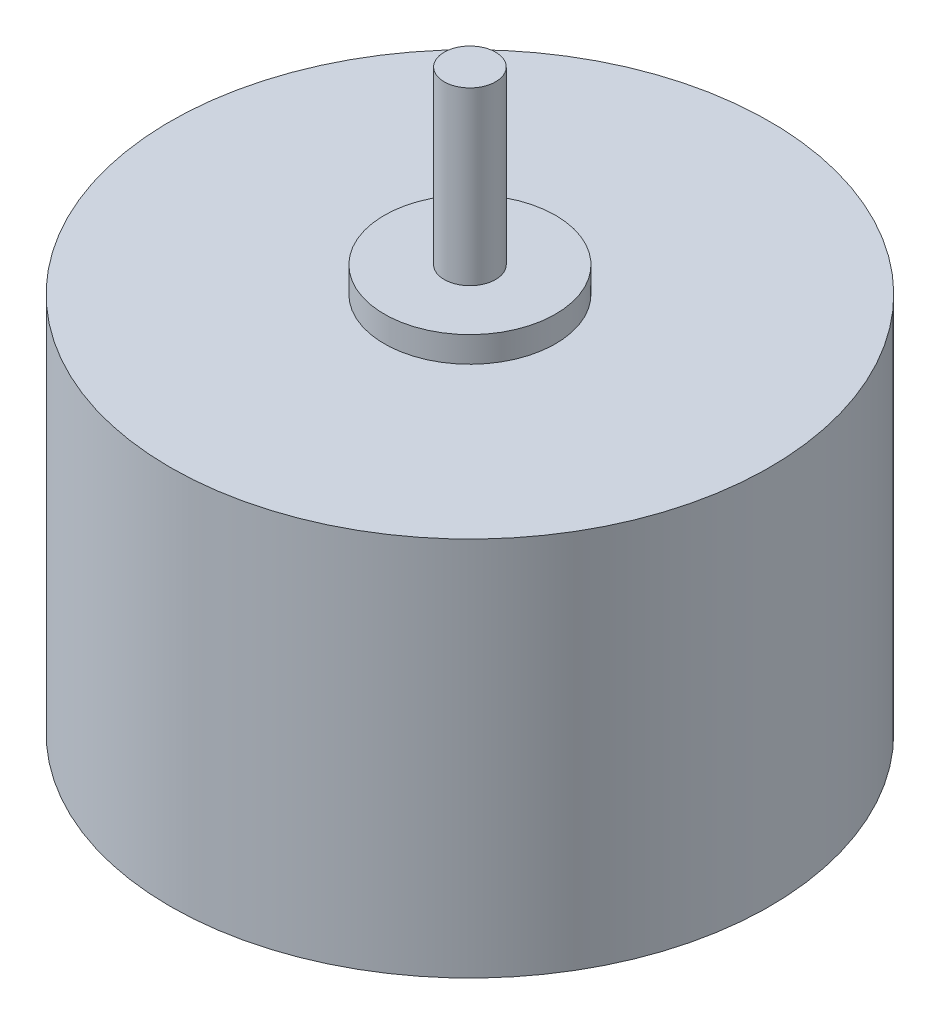
from build123d import *

# Parameters (mm, degrees)
SKETCH1_R           = 17.5
BOSS_EXTRUDE1_DEPTH = 22.2
SKETCH2_R           = 5
BOSS_EXTRUDE2_DEPTH = 23.7
SKETCH3_R           = 1.5
BOSS_EXTRUDE3_DEPTH = 33.7


with BuildPart() as part:
    # Sketch1 → Boss-Extrude1 (new body)
    with BuildSketch(Plane(origin=(0, 0, 0), x_dir=(1, 0, 0), z_dir=(0, 1, 0))):
        with Locations(Location((0, 0, 0), (0, 0, 270))):
            Circle(SKETCH1_R)
    extrude(amount=BOSS_EXTRUDE1_DEPTH)

    # Sketch2 → Boss-Extrude2 (add)
    with BuildSketch(Plane(origin=(0, 0, 0), x_dir=(1, 0, 0), z_dir=(0, 1, 0))):
        with Locations(Location((0, 0, 0), (0, 0, 90))):
            Circle(SKETCH2_R)
    extrude(amount=BOSS_EXTRUDE2_DEPTH)

    # Sketch3 → Boss-Extrude3 (add)
    with BuildSketch(Plane(origin=(0, 0, 0), x_dir=(1, 0, 0), z_dir=(0, 1, 0))):
        with Locations(Location((0, 0, 0), (0, 0, 270))):
            Circle(SKETCH3_R)
    extrude(amount=BOSS_EXTRUDE3_DEPTH)


solid = part.part
